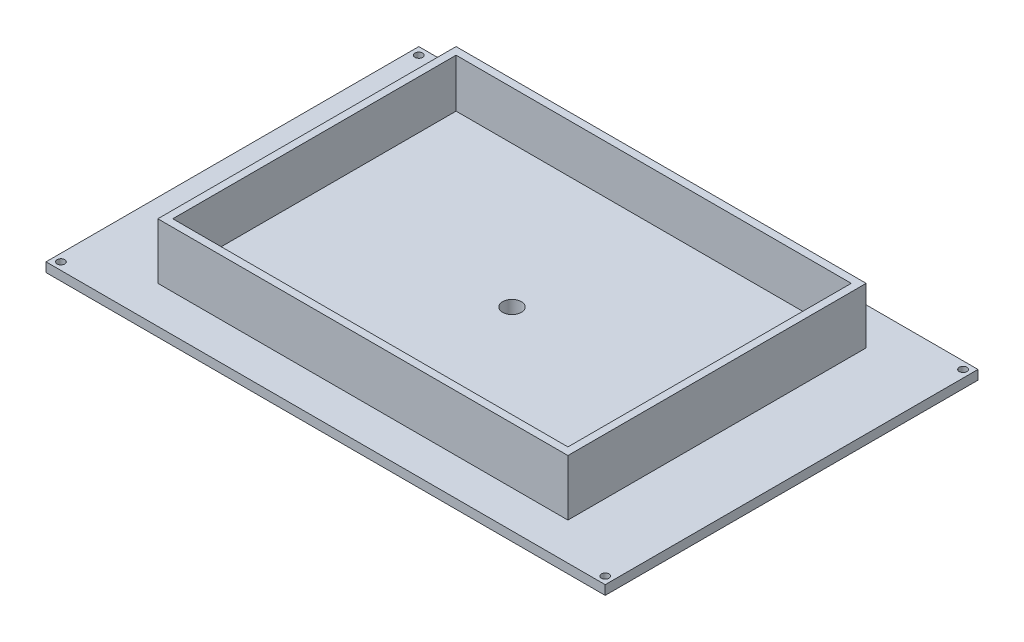
from build123d import *

# Parameters (mm, degrees)
SKETCH2_W           = 220
SKETCH2_H           = 160
BOSS_EXTRUDE1_DEPTH = 30
SKETCH3_W           = 212
SKETCH3_H           = 152
CUT_EXTRUDE1_DEPTH  = 26
SKETCH4_W           = 300
SKETCH4_H           = 200
BOSS_EXTRUDE2_DEPTH = 5
CUT_EXTRUDE2_REACH  = 185.644
SKETCH5_R           = 2.05
SKETCH6_R           = 5
CUT_EXTRUDE3_DEPTH  = 183.14280112


with BuildPart() as part:
    # Sketch2 → Boss-Extrude1 (new body)
    with BuildSketch(Plane(origin=(0, 0, 0), x_dir=(1, 0, 0), z_dir=(0, 1, 0))):
        Rectangle(SKETCH2_W, SKETCH2_H)
    extrude(amount=BOSS_EXTRUDE1_DEPTH)

    # Sketch3 → Cut-Extrude1 (cut)
    with BuildSketch(Plane(origin=(0, 30, 0), x_dir=(1, 0, 0), z_dir=(0, 1, 0))):
        Rectangle(SKETCH3_W, SKETCH3_H)
    extrude(amount=-CUT_EXTRUDE1_DEPTH, mode=Mode.SUBTRACT)

    # Sketch4 → Boss-Extrude2 (add)
    with BuildSketch(Plane.XZ):
        Rectangle(SKETCH4_W, SKETCH4_H)
    extrude(amount=BOSS_EXTRUDE2_DEPTH)

    # Sketch5 → Cut-Extrude2 (cut, up to next)
    with BuildSketch(Plane.XZ.offset(5), mode=Mode.PRIVATE) as cut_extrude2_sk1:
        with Locations(Location((-146, 96, 0), (0, 0, 270))):
            Circle(SKETCH5_R)
    cut_extrude2_tool1 = extrude(cut_extrude2_sk1.sketch, amount=-CUT_EXTRUDE2_REACH, mode=Mode.PRIVATE) & part.part
    # Sketch5 → Cut-Extrude2 (cut, up to next)
    with BuildSketch(Plane.XZ.offset(5), mode=Mode.PRIVATE) as cut_extrude2_sk2:
        with Locations(Location((146, 96, 0), (0, 0, 90))):
            Circle(SKETCH5_R)
    cut_extrude2_tool2 = extrude(cut_extrude2_sk2.sketch, amount=-CUT_EXTRUDE2_REACH, mode=Mode.PRIVATE) & part.part
    # Sketch5 → Cut-Extrude2 (cut, up to next)
    with BuildSketch(Plane.XZ.offset(5), mode=Mode.PRIVATE) as cut_extrude2_sk3:
        with Locations(Location((146, -96, 0), (0, 0, 270))):
            Circle(SKETCH5_R)
    cut_extrude2_tool3 = extrude(cut_extrude2_sk3.sketch, amount=-CUT_EXTRUDE2_REACH, mode=Mode.PRIVATE) & part.part
    # Sketch5 → Cut-Extrude2 (cut, up to next)
    with BuildSketch(Plane.XZ.offset(5), mode=Mode.PRIVATE) as cut_extrude2_sk4:
        with Locations(Location((-146, -96, 0), (0, 0, 90))):
            Circle(SKETCH5_R)
    cut_extrude2_tool4 = extrude(cut_extrude2_sk4.sketch, amount=-CUT_EXTRUDE2_REACH, mode=Mode.PRIVATE) & part.part
    add(cut_extrude2_tool1.solids().sort_by_distance((-146, -5, 96))[0], mode=Mode.SUBTRACT)
    add(cut_extrude2_tool2.solids().sort_by_distance((146, -5, 96))[0], mode=Mode.SUBTRACT)
    add(cut_extrude2_tool3.solids().sort_by_distance((146, -5, -96))[0], mode=Mode.SUBTRACT)
    add(cut_extrude2_tool4.solids().sort_by_distance((-146, -5, -96))[0], mode=Mode.SUBTRACT)

    # Sketch6 → Cut-Extrude3 (cut, through all)
    with BuildSketch(Plane(origin=(0, 4, 0), x_dir=(1, 0, 0), z_dir=(0, 1, 0))):
        with Locations(Location((0, 0, 0), (0, 0, 270))):
            Circle(SKETCH6_R)
    extrude(amount=-CUT_EXTRUDE3_DEPTH, mode=Mode.SUBTRACT)


solid = part.part
